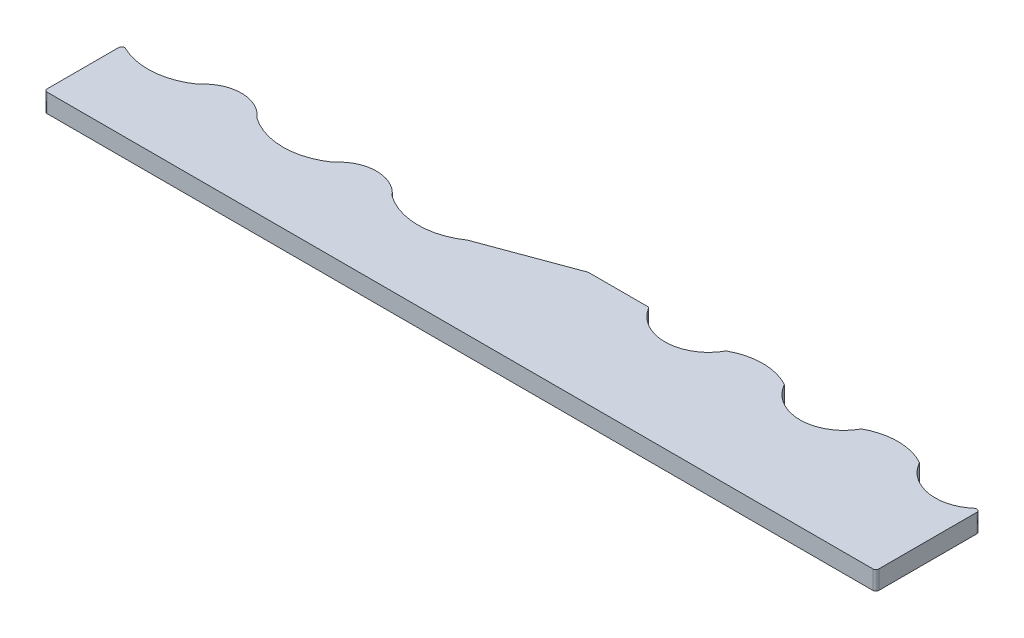
from build123d import *

# Parameters (mm, degrees)
BOSS_EXTRUDE1_DEPTH = 3.2
SKETCH2_W           = 159.499713068
SKETCH2_H           = 43.7032655
CUT_EXTRUDE1_DEPTH  = 3.2
FILLET1_R           = 0.5


with BuildPart() as part:
    # Sketch1 → Boss-Extrude1 (new body)
    with BuildSketch(Plane(origin=(0, 0, 0), x_dir=(1, 0, 0), z_dir=(0, 1, 0))):
        with BuildLine():
            Line((-52.508964924, -8.867320879), (-52.508964924, -23.867320879))
            Line((-52.508964924, -23.867320879), (90.983964924, -23.867320879))
            Line((90.983964924, -23.867320879), (90.983964924, -3.232453337))
            ThreePointArc((90.983964924, -3.232453337), (84.775, -7), (78.566035076, -3.232453337))
            ThreePointArc((78.566035076, -3.232453337), (73.2, -1.808851774), (67.833964924, -3.232453337))
            ThreePointArc((67.833964924, -3.232453337), (61.625, -7), (55.416035076, -3.232453337))
            ThreePointArc((55.416035076, -3.232453337), (50.05, -1.808851774), (44.683964924, -3.232453337))
            ThreePointArc((44.683964924, -3.232453337), (38.475, -7), (32.266035076, -3.232453337))
            Line((32.266035076, -3.232453337), (21.492035076, -3.232453337))
            Line((21.492035076, -3.232453337), (6.208964923, -8.867320879))
            ThreePointArc((6.208964923, -8.867320879), (0, -10.825), (-6.208964924, -8.867320879))
            ThreePointArc((-6.208964924, -8.867320879), (-11.575, -6.362392354), (-16.941035077, -8.867320879))
            ThreePointArc((-16.941035077, -8.867320879), (-23.15, -10.825), (-29.358964924, -8.867320879))
            ThreePointArc((-29.358964924, -8.867320879), (-34.725, -6.362392354), (-40.091035076, -8.867320879))
            ThreePointArc((-40.091035076, -8.867320879), (-46.3, -10.825), (-52.508964924, -8.867320879))
        make_face()
    extrude(amount=BOSS_EXTRUDE1_DEPTH)

    # Sketch2 → Cut-Extrude1 (cut)
    with BuildSketch(Plane(origin=(0, 3.2, 0), x_dir=(1, 0, 0), z_dir=(0, 1, 0))):
        with Locations((19.511770452, -6.74153154)):
            Rectangle(SKETCH2_W, SKETCH2_H)
        with BuildLine():
            Line((-52.008964924, -9.780764004), (-52.008964924, -23.367320879))
            Line((-52.008964924, -23.367320879), (90.483964924, -23.367320879))
            Line((90.483964924, -23.367320879), (90.483964924, -4.863920178))
            ThreePointArc((90.483964924, -4.863920178), (84.005832381, -7.460454488), (78.193740084, -3.596806627))
            ThreePointArc((78.193740084, -3.596806627), (73.2, -2.308851774), (68.206259916, -3.596806627))
            ThreePointArc((68.206259916, -3.596806627), (61.625, -7.5), (55.043740084, -3.596806627))
            ThreePointArc((55.043740084, -3.596806627), (50.05, -2.308851774), (45.056259916, -3.596806627))
            ThreePointArc((45.056259916, -3.596806627), (38.552735975, -7.49959713), (31.969710453, -3.732453337))
            Line((31.969710453, -3.732453337), (21.581273902, -3.732453337))
            Line((21.581273902, -3.732453337), (6.442002791, -9.314302177))
            ThreePointArc((6.442002791, -9.314302177), (-0.066748771, -11.324803292), (-6.551349026, -9.237718925))
            ThreePointArc((-6.551349026, -9.237718925), (-11.575, -6.862392354), (-16.598650974, -9.237718925))
            ThreePointArc((-16.598650974, -9.237718925), (-23.15, -11.325), (-29.701349026, -9.237718925))
            ThreePointArc((-29.701349026, -9.237718925), (-34.725, -6.862392354), (-39.748650974, -9.237718925))
            ThreePointArc((-39.748650974, -9.237718925), (-45.798874034, -11.313907272), (-52.008964924, -9.780764004))
        make_face(mode=Mode.SUBTRACT)
    extrude(amount=-CUT_EXTRUDE1_DEPTH, mode=Mode.SUBTRACT)

    # Fillet1
    fillet1_edges = [part.edges().sort_by_distance(p)[0] for p in [
        (21.581273902, 1.6, 3.732453337),
        (31.969710453, 1.6, 3.732453337),
        (90.483964924, 1.6, 4.863920178),
        (90.483964924, 1.6, 23.367320879),
        (-52.008964924, 1.6, 23.367320879),
        (-52.008964924, 1.6, 9.780764004),
    ]]
    fillet(fillet1_edges, radius=FILLET1_R)


solid = part.part
